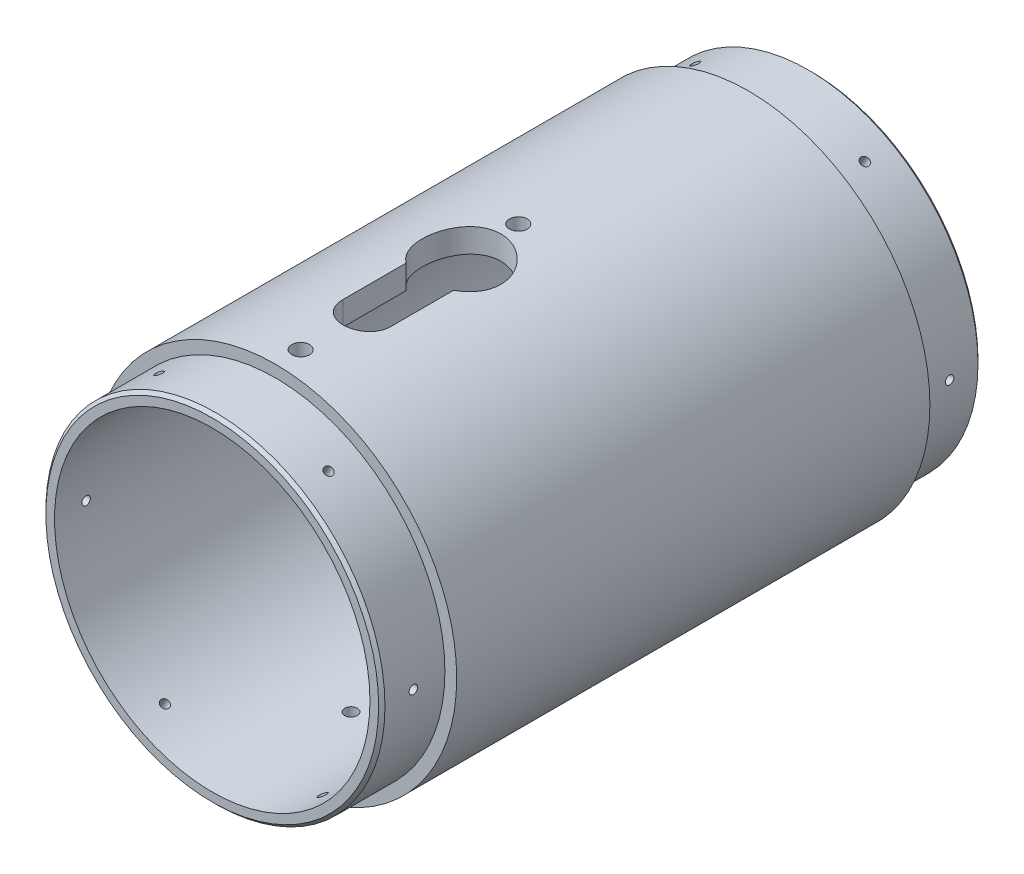
from build123d import *

# Parameters (mm, degrees)
SKETCH1_R                                          = 73.025
SKETCH1_R_2                                        = 63.5
BOSS_EXTRUDE1_DEPTH                                = 120.65
SKETCH3_R                                          = 15.875
CUT_EXTRUDE2_DEPTH                                 = 159.813487305
SKETCH7_R                                          = 73.025
SKETCH7_R_2                                        = 68.2625
CUT_EXTRUDE3_DEPTH                                 = 25.4
F_8_32_TAPPED_HOLE1_REACH                          = 214.423
F_8_32_TAPPED_HOLE1_BORE_R                         = 1.7272
CIRPATTERN1_COUNT                                  = 6
MIRROR1_COPY_1_REACH                               = 214.423
MIRROR1_COPY_1_SKETCH_R                            = 1.7272
MIRROR1_COPY_2_REACH                               = 214.423
MIRROR1_COPY_2_SKETCH_R                            = 1.7272
MIRROR1_COPY_3_REACH                               = 214.423
MIRROR1_COPY_3_SKETCH_R                            = 1.7272
MIRROR1_COPY_4_REACH                               = 214.423
MIRROR1_COPY_4_SKETCH_R                            = 1.7272
MIRROR1_COPY_5_REACH                               = 214.423
MIRROR1_COPY_5_SKETCH_R                            = 1.7272
CHAMFER1_SIZE                                      = 1.27
CSK_FOR_10_FLAT_HEAD_SOCKET_CAP_SCREW1_D           = 5.1054
CSK_FOR_10_FLAT_HEAD_SOCKET_CAP_SCREW1_DEPTH       = 25.4
CSK_FOR_10_FLAT_HEAD_SOCKET_CAP_SCREW1_CSINK_D     = 10.8810044
CSK_FOR_10_FLAT_HEAD_SOCKET_CAP_SCREW1_CSINK_ANGLE = 82
CSK_FOR_10_FLAT_HEAD_SOCKET_CAP_SCREW1_TIP         = 1.533816902
SKETCH16_W                                         = 3.571875
SKETCH16_H                                         = 73.025
F_9_32_0_28125_DIAMETER_HOLE1_AT_2_COUNT           = 2
F_9_32_0_28125_DIAMETER_HOLE1_AT_2_PITCH           = 87.63


with BuildPart() as part:
    # Sketch1 → Boss-Extrude1 (new, symmetric)
    with BuildSketch(Plane.XY):
        with Locations(Location((0, 0, 0), (0, 0, 180))):
            Circle(SKETCH1_R)
        with Locations(Location((0, 0, 0), (0, 0, 180))):
            Circle(SKETCH1_R_2, mode=Mode.SUBTRACT)
    extrude(amount=BOSS_EXTRUDE1_DEPTH, both=True)

    # Sketch3 → Cut-Extrude2 (cut, through all)
    with BuildSketch(Plane(origin=(0, 0, 0), x_dir=(1, 0, 0), z_dir=(0, 1, 0))):
        with Locations((0, -20.32)):
            Circle(SKETCH3_R)
        with BuildLine():
            Line((9.525, -29.845), (9.525, -58.42))
            ThreePointArc((9.525, -58.42), (0, -67.945), (-9.525, -58.42))
            Line((-9.525, -58.42), (-9.525, -29.845))
            ThreePointArc((-9.525, -29.845), (0, -20.32), (9.525, -29.845))
        make_face()
    extrude(amount=CUT_EXTRUDE2_DEPTH, mode=Mode.SUBTRACT)

    # Sketch7 → Cut-Extrude3 (cut)
    with BuildSketch(Plane.XY.offset(120.65)):
        Circle(SKETCH7_R)
        Circle(SKETCH7_R_2, mode=Mode.SUBTRACT)
    cut_extrude3 = extrude(amount=-CUT_EXTRUDE3_DEPTH, mode=Mode.SUBTRACT)

    # #8-32 Tapped Hole1 bore → #8-32 Tapped Hole1 (cut, up to next)
    with BuildSketch(Plane(origin=(36.5125, 63.241505111, 0), x_dir=(0, 0, -1), z_dir=(0.500000000000001, 0.866025403784438, 0)), mode=Mode.PRIVATE) as f_8_32_tapped_hole1_sk1:
        with Locations((-107.95, 0)):
            Circle(F_8_32_TAPPED_HOLE1_BORE_R)
    f_8_32_tapped_hole1_tool1 = extrude(f_8_32_tapped_hole1_sk1.sketch, amount=-F_8_32_TAPPED_HOLE1_REACH, mode=Mode.PRIVATE) & part.part
    f_8_32_tapped_hole1 = f_8_32_tapped_hole1_tool1.solids().sort_by_distance((36.5125, 63.241505, 107.95))[0]
    add(f_8_32_tapped_hole1, mode=Mode.SUBTRACT)

    # CirPattern1: #8-32 Tapped Hole1 ×6 about axis
    cirpattern1_axis = Axis((0, 0, 120.65), (0, 0, 1))
    for i in range(1, CIRPATTERN1_COUNT):
        add(f_8_32_tapped_hole1.rotate(cirpattern1_axis, i * 360 / CIRPATTERN1_COUNT), mode=Mode.SUBTRACT)

    # Mirror1: Cut-Extrude3, #8-32 Tapped Hole1 across plane
    add(cut_extrude3.mirror(Plane.XY), mode=Mode.SUBTRACT)
    add(f_8_32_tapped_hole1.mirror(Plane.XY), mode=Mode.SUBTRACT)

    # Mirror1 copy 1 sketch → Mirror1 copy 1 (cut, up to next)
    with BuildSketch(Plane(origin=(-36.5125, 63.241505111, 0), x_dir=(0, 0, 1), z_dir=(-0.4999999999999989, 0.8660254037844393, 0)), mode=Mode.PRIVATE) as mirror1_copy_1_sk1:
        with Locations((-107.95, 0)):
            Circle(MIRROR1_COPY_1_SKETCH_R)
    mirror1_copy_1_tool1 = extrude(mirror1_copy_1_sk1.sketch, amount=-MIRROR1_COPY_1_REACH, mode=Mode.PRIVATE) & part.part
    add(mirror1_copy_1_tool1.solids().sort_by_distance((-36.512499904, 63.241505056, -107.95))[0], mode=Mode.SUBTRACT)

    # Mirror1 copy 2 sketch → Mirror1 copy 2 (cut, up to next)
    with BuildSketch(Plane.ZY.offset(73.025), mode=Mode.PRIVATE) as mirror1_copy_2_sk1:
        with Locations((-107.95, 0)):
            Circle(MIRROR1_COPY_2_SKETCH_R)
    mirror1_copy_2_tool1 = extrude(mirror1_copy_2_sk1.sketch, amount=-MIRROR1_COPY_2_REACH, mode=Mode.PRIVATE) & part.part
    add(mirror1_copy_2_tool1.solids().sort_by_distance((-73.024999904, 5.6e-08, -107.95))[0], mode=Mode.SUBTRACT)

    # Mirror1 copy 3 sketch → Mirror1 copy 3 (cut, up to next)
    with BuildSketch(Plane(origin=(-36.5125, -63.241505111, 0), x_dir=(0, 0, 1), z_dir=(-0.5000000000000011, -0.8660254037844379, 0)), mode=Mode.PRIVATE) as mirror1_copy_3_sk1:
        with Locations((-107.95, 0)):
            Circle(MIRROR1_COPY_3_SKETCH_R)
    mirror1_copy_3_tool1 = extrude(mirror1_copy_3_sk1.sketch, amount=-MIRROR1_COPY_3_REACH, mode=Mode.PRIVATE) & part.part
    add(mirror1_copy_3_tool1.solids().sort_by_distance((-36.5125, -63.241505, -107.95))[0], mode=Mode.SUBTRACT)

    # Mirror1 copy 4 sketch → Mirror1 copy 4 (cut, up to next)
    with BuildSketch(Plane(origin=(36.5125, -63.241505111, 0), x_dir=(0, 0, 1), z_dir=(0.4999999999999985, -0.8660254037844395, 0)), mode=Mode.PRIVATE) as mirror1_copy_4_sk1:
        with Locations((-107.95, 0)):
            Circle(MIRROR1_COPY_4_SKETCH_R)
    mirror1_copy_4_tool1 = extrude(mirror1_copy_4_sk1.sketch, amount=-MIRROR1_COPY_4_REACH, mode=Mode.PRIVATE) & part.part
    add(mirror1_copy_4_tool1.solids().sort_by_distance((36.512499904, -63.241505056, -107.95))[0], mode=Mode.SUBTRACT)

    # Mirror1 copy 5 sketch → Mirror1 copy 5 (cut, up to next)
    with BuildSketch(Plane(origin=(73.025, 0, 0), x_dir=(0, 0, 1), z_dir=(1, 0, 0)), mode=Mode.PRIVATE) as mirror1_copy_5_sk1:
        with Locations((-107.95, 0)):
            Circle(MIRROR1_COPY_5_SKETCH_R)
    mirror1_copy_5_tool1 = extrude(mirror1_copy_5_sk1.sketch, amount=-MIRROR1_COPY_5_REACH, mode=Mode.PRIVATE) & part.part
    add(mirror1_copy_5_tool1.solids().sort_by_distance((73.024999904, -5.6e-08, -107.95))[0], mode=Mode.SUBTRACT)

    # Chamfer1
    chamfer1_edges = [part.edges().sort_by_distance(p)[0] for p in [
        (-68.2625, 0, 120.65),
        (-68.2625, 0, -120.65),
    ]]
    chamfer(chamfer1_edges, length=CHAMFER1_SIZE)

    # CSK for #10 Flat Head Socket Cap Screw1
    with Locations(Plane(origin=(0, -73.025, 0), x_dir=(0, 0, -1), z_dir=(0, -1, 0))):
        with Locations((-64.77, 0), (24.13, 0)):
            CounterSinkHole(CSK_FOR_10_FLAT_HEAD_SOCKET_CAP_SCREW1_D / 2, CSK_FOR_10_FLAT_HEAD_SOCKET_CAP_SCREW1_CSINK_D / 2, depth=CSK_FOR_10_FLAT_HEAD_SOCKET_CAP_SCREW1_DEPTH, counter_sink_angle=CSK_FOR_10_FLAT_HEAD_SOCKET_CAP_SCREW1_CSINK_ANGLE)
            with Locations((0, 0, -(CSK_FOR_10_FLAT_HEAD_SOCKET_CAP_SCREW1_DEPTH + CSK_FOR_10_FLAT_HEAD_SOCKET_CAP_SCREW1_TIP / 2))):  # 118° drill point
                Cone(0, CSK_FOR_10_FLAT_HEAD_SOCKET_CAP_SCREW1_D / 2, CSK_FOR_10_FLAT_HEAD_SOCKET_CAP_SCREW1_TIP, mode=Mode.SUBTRACT)

    # Sketch16 → 9/32 (0.28125) Diameter Hole1 (revolve, cut)
    with BuildSketch(Plane(origin=(0, 0, -2.54), x_dir=(0, 0, -1), z_dir=(1, 0, 0))):
        with Locations((1.7859375, 36.5125)):
            Rectangle(SKETCH16_W, SKETCH16_H)
    f_9_32_0_28125_diameter_hole1 = revolve(axis=Axis((0, -6.35, -2.54), (0, 1, 0)), mode=Mode.SUBTRACT)

    # 9/32 (0.28125) Diameter Hole1 at 2: 9/32 (0.28125) Diameter Hole1 ×2
    with Locations(*[(0, 0, i * F_9_32_0_28125_DIAMETER_HOLE1_AT_2_PITCH) for i in range(1, F_9_32_0_28125_DIAMETER_HOLE1_AT_2_COUNT)]):
        add(f_9_32_0_28125_diameter_hole1, mode=Mode.SUBTRACT)


solid = part.part
